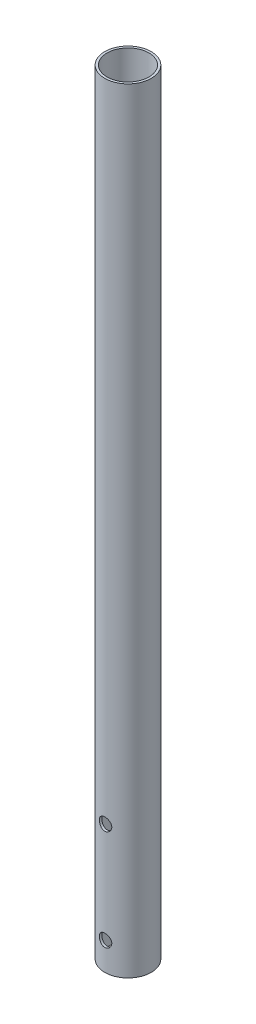
from build123d import *

# Parameters (mm, degrees)
SKETCH1_R               = 15
SKETCH1_R_2             = 13.5
BOSS_EXTRUDE1_DEPTH     = 500
CUT_EXTRUDE1_DEPTH      = 501.449797682
CUT_EXTRUDE1_DEPTH_BACK = 501.449797682
SKETCH2_R               = 4


with BuildPart() as part:
    # Sketch1 → Boss-Extrude1 (new body)
    with BuildSketch(Plane(origin=(0, 0, 0), x_dir=(1, 0, 0), z_dir=(0, 1, 0))):
        with Locations(Location((0, 0, 0), (0, 0, 270))):
            Circle(SKETCH1_R)
        with Locations(Location((0, 0, 0), (0, 0, 270))):
            Circle(SKETCH1_R_2, mode=Mode.SUBTRACT)
    extrude(amount=BOSS_EXTRUDE1_DEPTH)

    # Sketch2 → Cut-Extrude1 (cut, two sides: drawn at the far end of the back side and taken through both)
    with BuildSketch(Plane.XY.offset(-CUT_EXTRUDE1_DEPTH_BACK)):
        with Locations((0, 18)):
            Circle(SKETCH2_R)
        with Locations((0, 83)):
            Circle(SKETCH2_R)
    extrude(amount=CUT_EXTRUDE1_DEPTH + CUT_EXTRUDE1_DEPTH_BACK, mode=Mode.SUBTRACT)


solid = part.part
